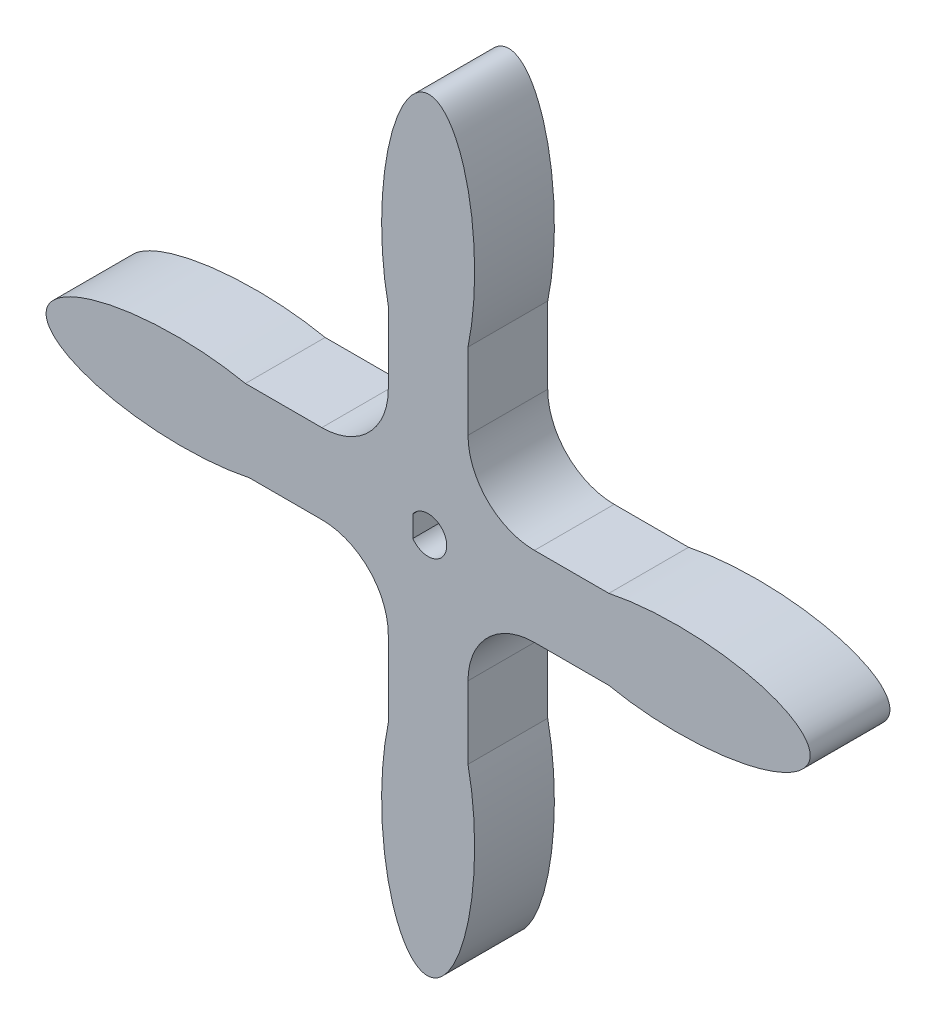
from build123d import *

# Parameters (mm, degrees)
SKETCH_2_W          = 95
SKETCH_2_H          = 12
EXTRUDE_2_DEPTH     = 12
SKETCH_7_W          = 12
SKETCH_7_H          = 95
EXTRUDE_6_DEPTH     = 12
SKETCH_5_RX         = 20
SKETCH_5_RY         = 7
SKETCH_5_RY_2       = 7.000177109
EXTRUDE_5_DEPTH     = 12
CUT_EXTRUDE_1_DEPTH = 10.5
FILLET_1_R          = 10
SKETCH_9_R          = 1.5
CUT_EXTRUDE_2_DEPTH = 82.992066392


with BuildPart() as part:
    # 草图2 → 凸台-拉伸2 (new body)
    with BuildSketch(Plane.XY):
        Rectangle(SKETCH_2_W, SKETCH_2_H)
    extrude(amount=EXTRUDE_2_DEPTH)

    # 草图7 → 凸台-拉伸6 (add)
    with BuildSketch(Plane.XY.offset(12)):
        Rectangle(SKETCH_7_W, SKETCH_7_H)
    extrude(amount=-EXTRUDE_6_DEPTH)

    # 草图5 → 凸台-拉伸5 (add)
    with BuildSketch(Plane(origin=(0, 0, 0), x_dir=(-1, 0, 0), z_dir=(0, 0, -1))):
        with Locations(Location((-37.5, 0), (0, 0, 0))):
            Ellipse(SKETCH_5_RX, SKETCH_5_RY)
        with Locations(Location((0, 37.5), (0, 0, 90.407571877))):
            Ellipse(SKETCH_5_RX, SKETCH_5_RY_2)
        with Locations(Location((37.5, 0), (0, 0, 0.407571877))):
            Ellipse(SKETCH_5_RX, SKETCH_5_RY_2)
        with Locations(Location((0, -37.5), (0, 0, -89.592428123))):
            Ellipse(SKETCH_5_RX, SKETCH_5_RY_2)
    extrude(amount=-EXTRUDE_5_DEPTH)

    # 草图8 → 切除-拉伸1 (cut)
    with BuildSketch(Plane.XY.offset(12)):
        with BuildLine():
            ThreePointArc((2.8, 0), (0.836660027, 2.672077843), (-2.3, 1.596871942))
            Line((-2.3, 1.596871942), (-2.3, -1.596871942))
            ThreePointArc((-2.3, -1.596871942), (0.836660027, -2.672077843), (2.8, 0))
        make_face()
    extrude(amount=-CUT_EXTRUDE_1_DEPTH, mode=Mode.SUBTRACT)

    # 圆角1
    fillet_1_edges = [part.edges().sort_by_distance(p)[0] for p in [
        (6, 6, 6),
        (6, -6, 6),
        (-6, 6, 6),
        (-6, -6, 6),
    ]]
    fillet(fillet_1_edges, radius=FILLET_1_R)

    # 草图9 → 切除-拉伸2 (cut, through all)
    with BuildSketch(Plane.XY.offset(1.5)):
        Circle(SKETCH_9_R)
    extrude(amount=-CUT_EXTRUDE_2_DEPTH, mode=Mode.SUBTRACT)


solid = part.part
